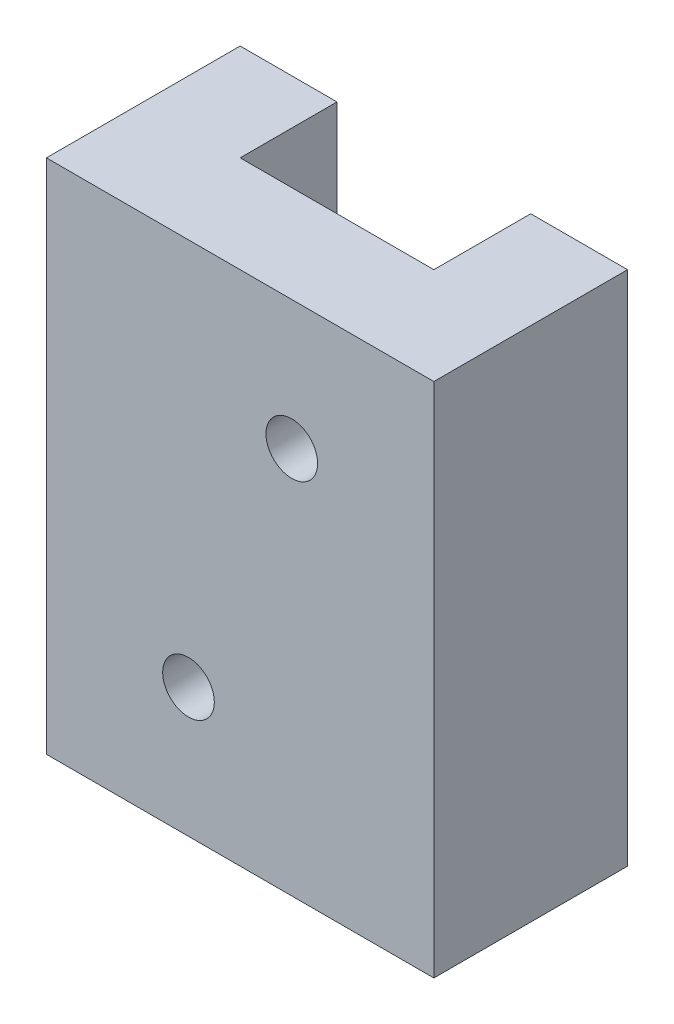
from build123d import *

# Parameters (mm, degrees)
BOSS_EXTRU_2_DEPTH      = 20
ESQUISSE3_R             = 1
ENL_V_MAT_EXTRU_2_DEPTH = 3.75


with BuildPart() as part:
    # Esquisse1 → Boss.-Extru.2 (new body)
    with BuildSketch(Plane(origin=(0, 0, 0), x_dir=(1, 0, 0), z_dir=(0, 1, 0))):
        Polygon((-3.75, 0), (-7.5, 0), (-7.5, -7.5), (7.5, -7.5), (7.5, 0), (3.75, 0), (3.75, -3.75), (-3.75, -3.75), align=None)
    extrude(amount=BOSS_EXTRU_2_DEPTH)

    # Esquisse3 → Enlèv. mat.-Extru.2 (cut)
    with BuildSketch(Plane.XY.offset(7.5)):
        with Locations((2, 15)):
            Circle(ESQUISSE3_R)
        with Locations((-2, 5)):
            Circle(ESQUISSE3_R)
    extrude(amount=-ENL_V_MAT_EXTRU_2_DEPTH, mode=Mode.SUBTRACT)


solid = part.part
